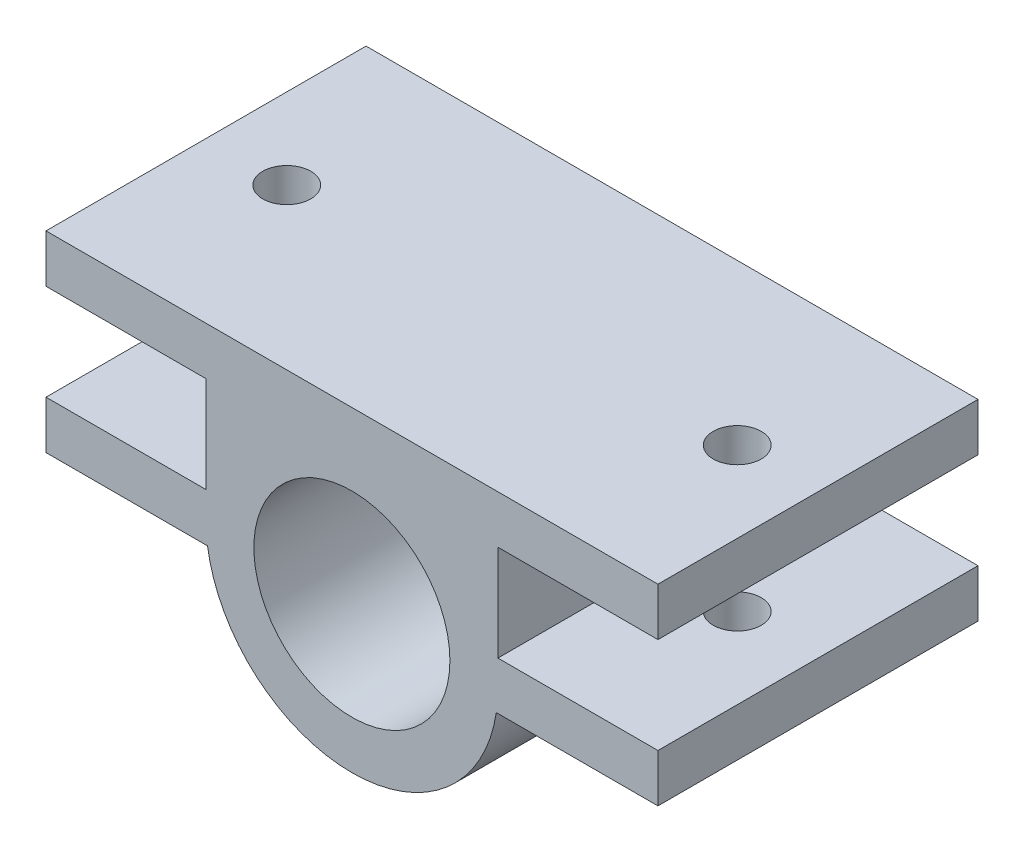
from build123d import *

# Parameters (mm, degrees)
ESQUISSE1_R                  = 6.125
BOSS_EXTRU_1_DEPTH           = 20
ENL_V_MAT_EXTRU_1_DEPTH      = 31.16232128
ENL_V_MAT_EXTRU_1_DEPTH_BACK = 31.16232128
ESQUISSE2_R                  = 1.5


with BuildPart() as part:
    # Esquisse1 → Boss.-Extru.1 (new body)
    with BuildSketch(Plane.XY):
        with BuildLine():
            ThreePointArc((-9.023082899, -1.36), (0, -9.125), (9.023082899, -1.36))
            Line((9.023082899, -1.36), (19.125, -1.36))
            Line((19.125, -1.36), (19.125, 1.64))
            Line((19.125, 1.64), (9.125, 1.64))
            Line((9.125, 1.64), (9.125, 7.64))
            Line((9.125, 7.64), (19.125, 7.64))
            Line((19.125, 7.64), (19.125, 10.64))
            Line((19.125, 10.64), (-19.11513432, 10.64))
            Line((-19.11513432, 10.64), (-19.11513432, 7.64))
            Line((-19.11513432, 7.64), (-9.11513432, 7.64))
            Line((-9.11513432, 7.64), (-9.11513432, 1.64))
            Line((-9.11513432, 1.64), (-19.11513432, 1.64))
            Line((-19.11513432, 1.64), (-19.11513432, -1.36))
            Line((-19.11513432, -1.36), (-9.023082899, -1.36))
        make_face()
        Circle(ESQUISSE1_R, mode=Mode.SUBTRACT)
    extrude(amount=BOSS_EXTRU_1_DEPTH)

    # Esquisse2 → Enlèv. mat.-Extru.1 (cut, two sides: drawn at the far end of the back side and taken through both)
    with BuildSketch(Plane.XZ.offset(1.36).offset(-ENL_V_MAT_EXTRU_1_DEPTH_BACK)):
        with Locations(Location((-14.07013432, 10, 0), (0, 0, 180))):
            Circle(ESQUISSE2_R)
        with Locations(Location((14.08, 10, 0), (0, 0, 270))):
            Circle(ESQUISSE2_R)
    extrude(amount=ENL_V_MAT_EXTRU_1_DEPTH + ENL_V_MAT_EXTRU_1_DEPTH_BACK, mode=Mode.SUBTRACT)


solid = part.part
